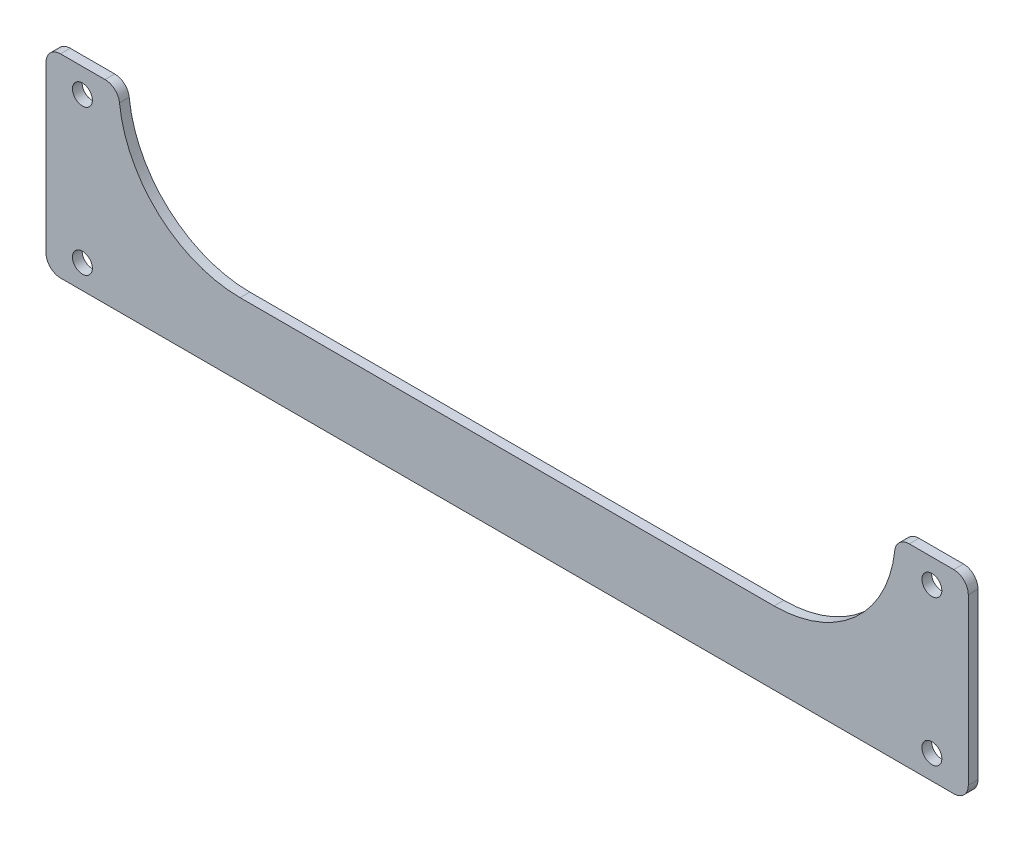
from build123d import *

# Parameters (mm, degrees)
SKETCH_1_W          = 190
SKETCH_1_H          = 40
EXTRUDE_1_DEPTH     = 2
CUT_EXTRUDE_1_DEPTH = 2
SKETCH_3_R          = 2.05
CUT_EXTRUDE_2_DEPTH = 2
FILLET_1_R          = 3


with BuildPart() as part:
    # 草图1 → 凸台-拉伸1 (new body)
    with BuildSketch(Plane.XY):
        Rectangle(SKETCH_1_W, SKETCH_1_H)
    extrude(amount=EXTRUDE_1_DEPTH)

    # 草图2 → 切除-拉伸1 (cut)
    with BuildSketch(Plane.XY.offset(2)):
        with BuildLine():
            Line((0, -5), (0, 20))
            Line((0, 20), (-80, 20))
            ThreePointArc((-80, 20), (-72.67766953, 2.32233047), (-55, -5))
            Line((-55, -5), (0, -5))
        make_face()
        with BuildLine():
            Line((80, 20), (0, 20))
            Line((0, 20), (0, -5))
            Line((0, -5), (55, -5))
            ThreePointArc((55, -5), (72.67766953, 2.32233047), (80, 20))
        make_face()
    extrude(amount=-CUT_EXTRUDE_1_DEPTH, mode=Mode.SUBTRACT)

    # 草图3 → 切除-拉伸2 (cut)
    with BuildSketch(Plane.XY.offset(2)):
        with Locations((-87.5, 15)):
            Circle(SKETCH_3_R)
        with Locations((-87.5, -15)):
            Circle(SKETCH_3_R)
        with Locations(Location((87.5, -15, 0), (0, 0, 180))):
            Circle(SKETCH_3_R)
        with Locations(Location((87.5, 15, 0), (0, 0, 180))):
            Circle(SKETCH_3_R)
    extrude(amount=-CUT_EXTRUDE_2_DEPTH, mode=Mode.SUBTRACT)

    # 圆角1
    fillet_1_edges = [part.edges().sort_by_distance(p)[0] for p in [
        (-80, 20, 1),
        (80, 20, 1),
        (95, -20, 1),
        (-95, -20, 1),
        (-95, 20, 1),
        (95, 20, 1),
    ]]
    fillet(fillet_1_edges, radius=FILLET_1_R)


solid = part.part
